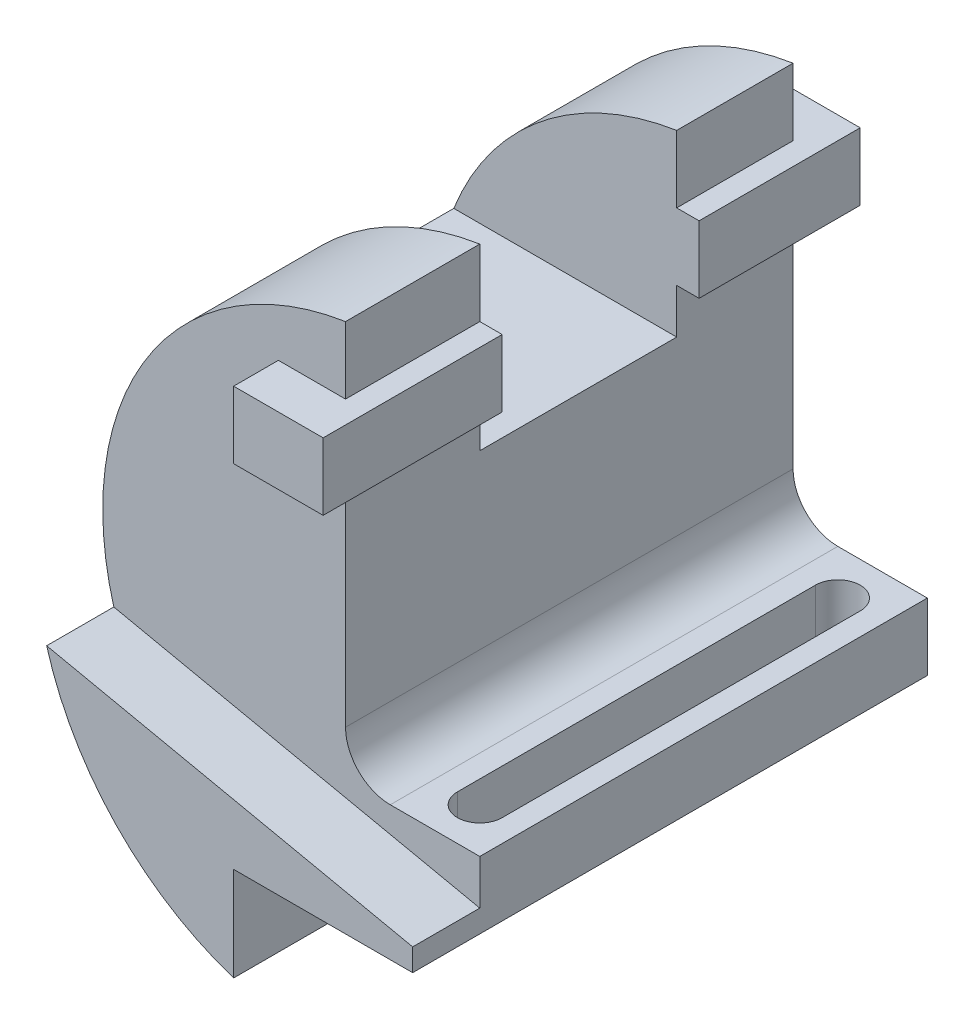
from build123d import *

# Parameters (mm, degrees)
BOSS_EXTRU_1_DEPTH      = 115
ENL_V_START             = -15
ENL_V_MAT_EXTRU_1_DEPTH = 15
BOSS_EXTRU_2_START      = -110
ESQUISSE3_W             = 20
ESQUISSE3_H             = 15
BOSS_EXTRU_2_DEPTH      = 120
ESQUISSE4_W             = 44
ESQUISSE4_H             = 40
ENL_V_MAT_EXTRU_2_DEPTH = 145.095888213
ENL_V_MAT_EXTRU_3_DEPTH = 159.698810645


with BuildPart() as part:
    # Esquisse1 → Boss.-Extru.1 (new body)
    with BuildSketch(Plane.XY):
        with BuildLine():
            Line((-10, 63.467018994), (-10, -15.032981006))
            ThreePointArc((-10, -15.032981006), (-7.071067812, -22.104048818), (0, -25.032981006))
            Line((0, -25.032981006), (20, -25.032981006))
            Line((20, -25.032981006), (20, -40.032981006))
            Line((20, -40.032981006), (-20, -40.032981006))
            Line((-20, -40.032981006), (-20, -61.057861902))
            ThreePointArc((-20, -61.057861902), (-64.043824765, 5.143054489), (-10, 63.467018994))
        make_face()
    extrude(amount=BOSS_EXTRU_1_DEPTH)

    # Esquisse2 → Enlèv. mat.-Extru.1 (cut)
    with BuildSketch(Plane.XY.offset(115).offset(ENL_V_START)):
        with BuildLine():
            Line((20, -35.032981006), (-61.777999904, -17.650530526))
            ThreePointArc((-61.777999904, -17.650530526), (-54.157497427, 34.569176623), (-10, 63.467018994))
            Line((-10, 63.467018994), (-10, -15.032981006))
            ThreePointArc((-10, -15.032981006), (-7.071067812, -22.104048818), (0, -25.032981006))
            Line((0, -25.032981006), (20, -25.032981006))
            Line((20, -25.032981006), (20, -35.032981006))
        make_face()
    extrude(amount=ENL_V_MAT_EXTRU_1_DEPTH, mode=Mode.SUBTRACT)

    # Esquisse3 → Boss.-Extru.2 (add)
    with BuildSketch(Plane.XY.offset(100).offset(BOSS_EXTRU_2_START)):
        with Locations((-15, 40.967018994)):
            Rectangle(ESQUISSE3_W, ESQUISSE3_H)
    extrude(amount=BOSS_EXTRU_2_DEPTH)

    # Esquisse4 → Enlèv. mat.-Extru.2 (cut, through all)
    with BuildSketch(Plane(origin=(-5, 0, 0), x_dir=(0, 0, -1), z_dir=(1, 0, 0))):
        with Locations((-48, 43.467018994)):
            Rectangle(ESQUISSE4_W, ESQUISSE4_H)
    extrude(amount=-ENL_V_MAT_EXTRU_2_DEPTH, mode=Mode.SUBTRACT)

    # Esquisse5 → Enlèv. mat.-Extru.3 (cut, through all)
    with BuildSketch(Plane(origin=(0, -25.032981006, 0), x_dir=(1, 0, 0), z_dir=(0, 1, 0))):
        with BuildLine():
            Line((15, -10), (15, -90))
            ThreePointArc((15, -90), (10, -95), (5, -90))
            Line((5, -90), (5, -10))
            ThreePointArc((5, -10), (10, -5), (15, -10))
        make_face()
    extrude(amount=-ENL_V_MAT_EXTRU_3_DEPTH, mode=Mode.SUBTRACT)


solid = part.part
